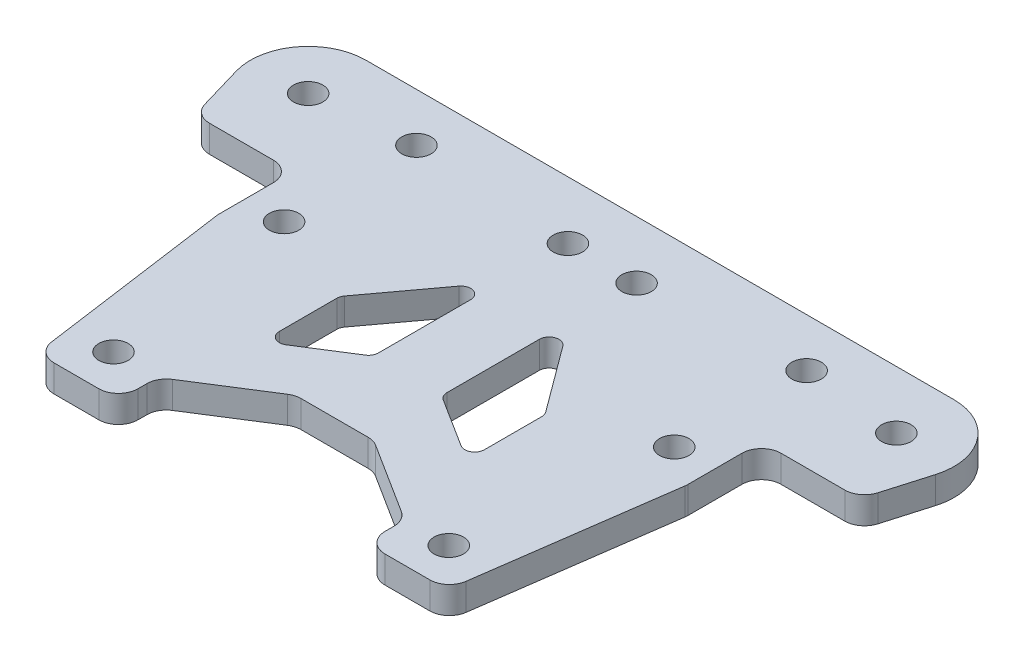
from build123d import *

# Parameters (mm, degrees)
RESSALTO_EXTRUS_O1_DEPTH = 2.75
ESBO_O4_R                = 1.5
CORTE_EXTRUS_O1_DEPTH    = 56.81185506


with BuildPart() as part:
    # Esboço3 → Ressalto-extrusão1 (new body)
    with BuildSketch(Plane(origin=(0, 0, 0), x_dir=(1, 0, 0), z_dir=(0, 1, 0))):
        with BuildLine():
            Line((-30, 0), (30, 0))
            ThreePointArc((30, 0), (34.716968698, -2.359969453), (35.656560331, -7.55))
            Line((35.656560331, -7.55), (34.321008321, -12.111933867))
            ThreePointArc((34.321008321, -12.111933867), (33.600767374, -13.150604219), (32.401573422, -13.55))
            Line((32.401573422, -13.55), (25.9, -13.55))
            ThreePointArc((25.9, -13.55), (24.485786438, -14.135786438), (23.9, -15.55))
            Line((23.9, -15.55), (23.9, -21.060817198))
            ThreePointArc((23.9, -21.060817198), (23.895174557, -21.199664191), (23.880721513, -21.337841185))
            Line((23.880721513, -21.337841185), (21.140975666, -40.927023988))
            ThreePointArc((21.140975666, -40.927023988), (20.472875962, -42.158981109), (19.160254154, -42.65))
            Line((19.160254154, -42.65), (14.6, -42.65))
            ThreePointArc((14.6, -42.65), (13.185786438, -42.064213562), (12.6, -40.65))
            Line((12.6, -40.65), (12.6, -39.750343786))
            ThreePointArc((12.6, -39.750343786), (12.352304612, -38.786275041), (11.670571453, -38.061001677))
            Line((11.670571453, -38.061001677), (4.490212451, -33.51065789))
            ThreePointArc((4.490212451, -33.51065789), (3.977007924, -33.279233978), (3.419640998, -33.2))
            Line((3.419640998, -33.2), (-3.419640998, -33.2))
            ThreePointArc((-3.419640998, -33.2), (-3.977007924, -33.279233978), (-4.490212451, -33.51065789))
            Line((-4.490212451, -33.51065789), (-11.670571453, -38.061001677))
            ThreePointArc((-11.670571453, -38.061001677), (-12.352304612, -38.786275041), (-12.6, -39.750343786))
            Line((-12.6, -39.750343786), (-12.6, -40.65))
            ThreePointArc((-12.6, -40.65), (-13.185786438, -42.064213562), (-14.6, -42.65))
            Line((-14.6, -42.65), (-19.160254154, -42.65))
            ThreePointArc((-19.160254154, -42.65), (-20.472875962, -42.158981109), (-21.140975666, -40.927023988))
            Line((-21.140975666, -40.927023988), (-23.880721513, -21.337841185))
            ThreePointArc((-23.880721513, -21.337841185), (-23.895174557, -21.199664191), (-23.9, -21.060817198))
            Line((-23.9, -21.060817198), (-23.9, -15.55))
            ThreePointArc((-23.9, -15.55), (-24.485786438, -14.135786438), (-25.9, -13.55))
            Line((-25.9, -13.55), (-32.401573422, -13.55))
            ThreePointArc((-32.401573422, -13.55), (-33.600767374, -13.150604219), (-34.321008321, -12.111933867))
            Line((-34.321008321, -12.111933867), (-35.656560331, -7.55))
            ThreePointArc((-35.656560331, -7.55), (-34.716968698, -2.359969453), (-30, 0))
        make_face()
    extrude(amount=RESSALTO_EXTRUS_O1_DEPTH)

    # Esboço4 → Corte-extrusão1 (cut, through all)
    with BuildSketch(Plane(origin=(0, 2.75, 0), x_dir=(1, 0, 0), z_dir=(0, 1, 0))):
        with Locations(Location((3.5, -5.893985085, 0), (0, 0, 270))):
            Circle(ESBO_O4_R)
        with Locations(Location((30, -5.893985085, 0), (0, 0, 270))):
            Circle(ESBO_O4_R)
        with Locations(Location((19.9, -4.95, 0), (0, 0, 270))):
            Circle(ESBO_O4_R)
        with Locations(Location((19.9, -18.45, 0), (0, 0, 270))):
            Circle(ESBO_O4_R)
        with Locations(Location((17.1, -38.65, 0), (0, 0, 270))):
            Circle(ESBO_O4_R)
        with Locations(Location((-3.5, -5.893985085, 0), (0, 0, 90))):
            Circle(ESBO_O4_R)
        with Locations(Location((-17.1, -38.65, 0), (0, 0, 90))):
            Circle(ESBO_O4_R)
        with Locations(Location((-19.9, -18.45, 0), (0, 0, 90))):
            Circle(ESBO_O4_R)
        with Locations(Location((-19.9, -4.95, 0), (0, 0, 90))):
            Circle(ESBO_O4_R)
        with Locations(Location((-30, -5.893985085, 0), (0, 0, 90))):
            Circle(ESBO_O4_R)
        with BuildLine():
            Line((3.5, -25.229610701), (3.5, -15.814435009))
            ThreePointArc((3.5, -15.814435009), (4.187027668, -14.864672766), (5.304096639, -15.219936401))
            Line((5.304096639, -15.219936401), (10.25973036, -21.922741689))
            ThreePointArc((10.25973036, -21.922741689), (10.405395965, -22.204267965), (10.455633721, -22.517240297))
            Line((10.455633721, -22.517240297), (10.455633721, -28.370099513))
            ThreePointArc((10.455633721, -28.370099513), (9.937668094, -29.246251819), (8.920347995, -29.214770568))
            Line((8.920347995, -29.214770568), (3.964714273, -26.074281756))
            ThreePointArc((3.964714273, -26.074281756), (3.623847694, -25.711645074), (3.5, -25.229610701))
        make_face()
        with BuildLine():
            Line((-8.920347995, -29.214770568), (-3.964714273, -26.074281756))
            ThreePointArc((-3.964714273, -26.074281756), (-3.623847694, -25.711645074), (-3.5, -25.229610701))
            Line((-3.5, -25.229610701), (-3.5, -15.814435009))
            ThreePointArc((-3.5, -15.814435009), (-4.187027668, -14.864672766), (-5.304096639, -15.219936401))
            Line((-5.304096639, -15.219936401), (-10.25973036, -21.922741689))
            ThreePointArc((-10.25973036, -21.922741689), (-10.405395965, -22.204267965), (-10.455633721, -22.517240297))
            Line((-10.455633721, -22.517240297), (-10.455633721, -28.370099513))
            ThreePointArc((-10.455633721, -28.370099513), (-9.937668094, -29.246251819), (-8.920347995, -29.214770568))
        make_face()
    extrude(amount=-CORTE_EXTRUS_O1_DEPTH, mode=Mode.SUBTRACT)


solid = part.part
